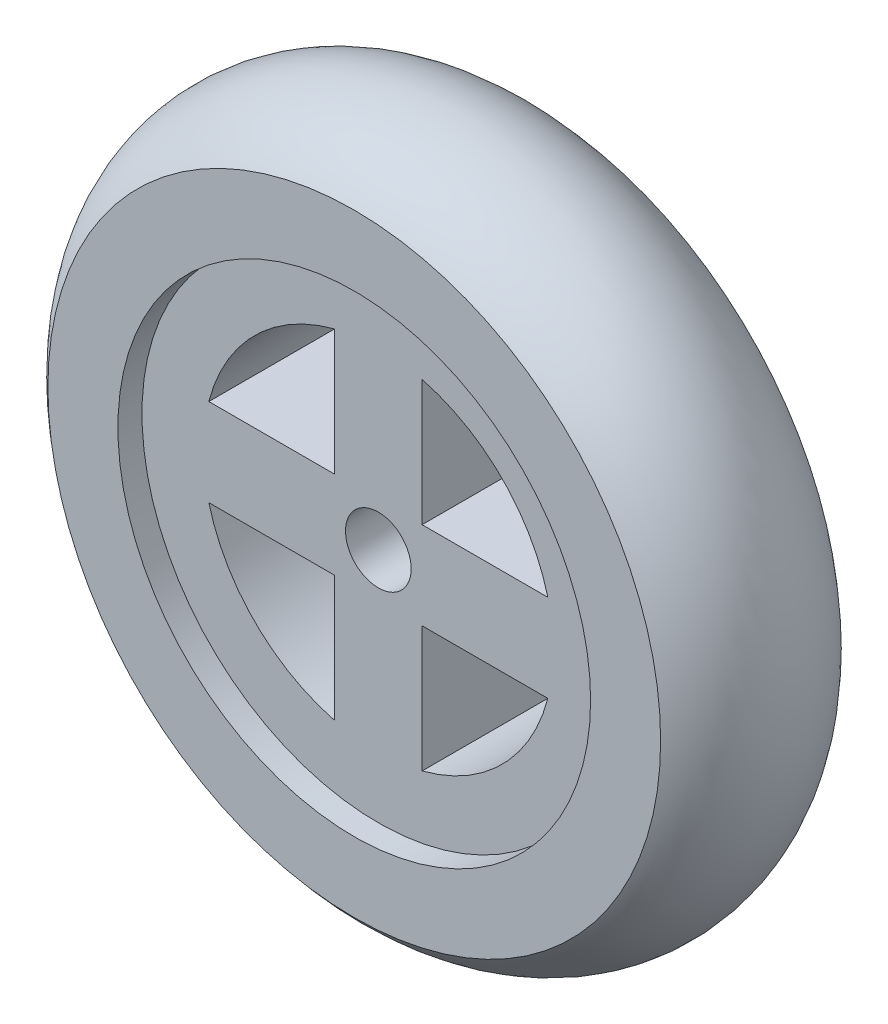
from build123d import *

# Parameters (mm, degrees)
SKETCH3_W               = 80
SKETCH3_H               = 30
BOSS_EXTRUDE3_DEPTH     = 10
SKETCH5_W               = 30
SKETCH5_H               = 80
BOSS_EXTRUDE4_DEPTH     = 10
CUT_EXTRUDE1_DEPTH      = 115.990220301
CUT_EXTRUDE1_DEPTH_BACK = 115.990220301
SKETCH7_R               = 7.5


with BuildPart() as part:
    # Sketch1 → Revolve1 (revolve)
    with BuildSketch(Plane(origin=(0, 0, 0), x_dir=(1, 0, 0), z_dir=(0, 1, 0))):
        with BuildLine():
            Line((40, 15), (40, -15))
            Line((40, -15), (54, -15))
            Line((54, -15), (54, -20.5))
            Line((54, -20.5), (70, -20.5))
            ThreePointArc((70, -20.5), (80.007814408, 0), (70, 20.5))
            Line((70, 20.5), (54, 20.5))
            Line((54, 20.5), (54, 15))
            Line((54, 15), (40, 15))
        make_face()
    revolve(axis=Axis((0, 0, 7131.725244947), (0, 0, -1)))

    # Sketch3 → Boss-Extrude3 (add, symmetric)
    with BuildSketch(Plane(origin=(0, 0, 0), x_dir=(1, 0, 0), z_dir=(0, 1, 0))):
        Rectangle(SKETCH3_W, SKETCH3_H)
    extrude(amount=BOSS_EXTRUDE3_DEPTH, both=True)

    # Sketch5 → Boss-Extrude4 (add, symmetric)
    with BuildSketch(Plane(origin=(0, 0, 0), x_dir=(0, 0, -1), z_dir=(1, 0, 0))):
        Rectangle(SKETCH5_W, SKETCH5_H)
    extrude(amount=BOSS_EXTRUDE4_DEPTH, both=True)

    # Sketch7 → Cut-Extrude1 (cut, two sides: drawn at the far end of the back side and taken through both)
    with BuildSketch(Plane.XY.offset(-CUT_EXTRUDE1_DEPTH_BACK)):
        Circle(SKETCH7_R)
    extrude(amount=CUT_EXTRUDE1_DEPTH + CUT_EXTRUDE1_DEPTH_BACK, mode=Mode.SUBTRACT)


solid = part.part
